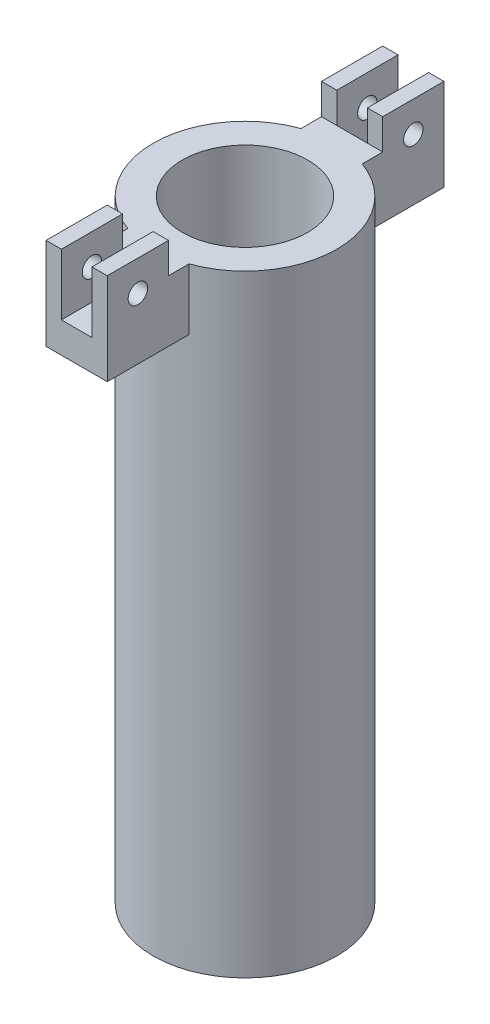
from build123d import *

# Parameters (mm, degrees)
SKETCH1_R           = 30
BOSS_EXTRUDE1_DEPTH = 100
SKETCH2_R           = 20.5
CUT_EXTRUDE1_DEPTH  = 150
SKETCH3_R           = 3.175
BOSS_EXTRUDE3_DEPTH = 10
CUT_EXTRUDE2_REACH  = 144.215
SKETCH4_W           = 10
SKETCH4_H           = 20


with BuildPart() as part:
    # Sketch1 → Boss-Extrude1 (new, symmetric)
    with BuildSketch(Plane(origin=(0, 0, 0), x_dir=(1, 0, 0), z_dir=(0, 1, 0))):
        with Locations(Location((0, 0, 0), (0, 0, 270))):
            Circle(SKETCH1_R)
    extrude(amount=BOSS_EXTRUDE1_DEPTH, both=True)

    # Sketch2 → Cut-Extrude1 (cut)
    with BuildSketch(Plane(origin=(0, 100, 0), x_dir=(1, 0, 0), z_dir=(0, 1, 0))):
        with Locations(Location((0, 0, 0), (0, 0, 270))):
            Circle(SKETCH2_R)
    extrude(amount=-CUT_EXTRUDE1_DEPTH, mode=Mode.SUBTRACT)

    # Sketch3 → Boss-Extrude3 (add, symmetric)
    with BuildSketch(Plane(origin=(0, 0, 0), x_dir=(0, 0, -1), z_dir=(1, 0, 0))):
        Polygon((20.5, 100), (35, 100), (35, 110), (55, 110), (55, 80), (20.5, 80), align=None)
        with Locations((45, 100)):
            Circle(SKETCH3_R, mode=Mode.SUBTRACT)
    boss_extrude3 = extrude(amount=BOSS_EXTRUDE3_DEPTH, both=True)

    # Cut-Extrude2: up to this face of the body (flat: up to its plane)
    cut_extrude2_end = Plane(part.part.faces().sort_by_distance((0, 105, -35))[0])
    # Sketch4 → Cut-Extrude2 (cut, up to the picked face)
    with BuildSketch(Plane(origin=(0, 0, -55), x_dir=(-1, 0, 0), z_dir=(0, 0, -1)), mode=Mode.PRIVATE) as cut_extrude2_sk1:
        with Locations((0, 100)):
            Rectangle(SKETCH4_W, SKETCH4_H)
    cut_extrude2_tool1 = split(extrude(cut_extrude2_sk1.sketch, amount=-CUT_EXTRUDE2_REACH, mode=Mode.PRIVATE), bisect_by=cut_extrude2_end, keep=Keep.BOTH, mode=Mode.PRIVATE)
    cut_extrude2 = cut_extrude2_tool1.solids().sort_by(Axis((0, 100, -55), (0, 0, 1)))[0]
    add(cut_extrude2, mode=Mode.SUBTRACT)

    # Mirror1: Boss-Extrude3, Cut-Extrude2 across plane
    add(boss_extrude3.mirror(Plane.XY))
    add(cut_extrude2.mirror(Plane.XY), mode=Mode.SUBTRACT)


solid = part.part
